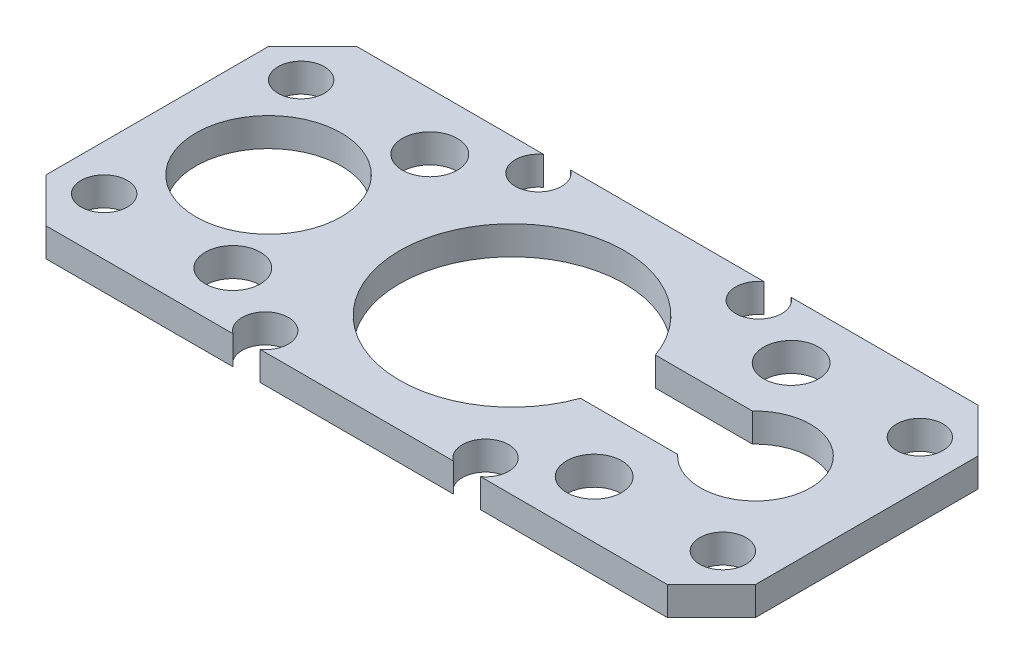
from build123d import *

# Parameters (mm, degrees)
SKETCH1_R           = 1.3335
SKETCH1_R_2         = 1.5875
BOSS_EXTRUDE1_DEPTH = 1.651
CHAMFER1_SIZE       = 2.54
SKETCH5_R           = 4.191
CUT_EXTRUDE5_DEPTH  = 23.382376376


with BuildPart() as part:
    # Sketch1 → Boss-Extrude1 (new body)
    with BuildSketch(Plane(origin=(0, 0, 0), x_dir=(1, 0, 0), z_dir=(0, 1, 0))):
        with BuildLine():
            Line((-5.567119422, 8.9535), (5.567119422, 8.9535))
            ThreePointArc((5.567119422, 8.9535), (6.35, 6.5405), (7.132880578, 8.9535))
            Line((7.132880578, 8.9535), (20.447, 8.9535))
            Line((20.447, 8.9535), (20.447, -8.9535))
            Line((20.447, -8.9535), (7.132880578, -8.9535))
            ThreePointArc((7.132880578, -8.9535), (6.35, -6.5405), (5.567119422, -8.9535))
            Line((5.567119422, -8.9535), (-5.567119422, -8.9535))
            ThreePointArc((-5.567119422, -8.9535), (-6.35, -6.5405), (-7.132880578, -8.9535))
            Line((-7.132880578, -8.9535), (-20.447, -8.9535))
            Line((-20.447, -8.9535), (-20.447, 8.9535))
            Line((-20.447, 8.9535), (-7.132880578, 8.9535))
            ThreePointArc((-7.132880578, 8.9535), (-6.35, 6.5405), (-5.567119422, 8.9535))
        make_face()
        with Locations(Location((-17.8308, 5.6769, 0), (0, 0, 90))):
            Circle(SKETCH1_R, mode=Mode.SUBTRACT)
        with Locations(Location((17.8308, 5.6769, 0), (0, 0, 90))):
            Circle(SKETCH1_R, mode=Mode.SUBTRACT)
        with Locations(Location((17.8308, -5.6769, 0), (0, 0, 90))):
            Circle(SKETCH1_R, mode=Mode.SUBTRACT)
        with Locations(Location((-17.8308, -5.6769, 0), (0, 0, 90))):
            Circle(SKETCH1_R, mode=Mode.SUBTRACT)
        with Locations(Location((-10.414, 5.6769, 0), (0, 0, 90))):
            Circle(SKETCH1_R_2, mode=Mode.SUBTRACT)
        with Locations(Location((10.414, 5.6769, 0), (0, 0, 90))):
            Circle(SKETCH1_R_2, mode=Mode.SUBTRACT)
        with Locations(Location((10.414, -5.6769, 0), (0, 0, 90))):
            Circle(SKETCH1_R_2, mode=Mode.SUBTRACT)
        with Locations(Location((-10.414, -5.6769, 0), (0, 0, 90))):
            Circle(SKETCH1_R_2, mode=Mode.SUBTRACT)
    extrude(amount=BOSS_EXTRUDE1_DEPTH)

    # Chamfer1
    chamfer1_edges = [part.edges().sort_by_distance(p)[0] for p in [
        (20.447, 0.8255, -8.9535),
        (20.447, 0.8255, 8.9535),
        (-20.447, 0.8255, 8.9535),
        (-20.447, 0.8255, -8.9535),
    ]]
    chamfer(chamfer1_edges, length=CHAMFER1_SIZE)

    # Sketch5 → Cut-Extrude5 (cut, through all)
    with BuildSketch(Plane(origin=(0, 1.651, 0), x_dir=(1, 0, 0), z_dir=(0, 1, 0))):
        with Locations(Location((-14.0335, 0, 0), (0, 0, 270))):
            Circle(SKETCH5_R)
        with BuildLine():
            Line((6.106574162, -2.159), (11.705551547, -2.159))
            ThreePointArc((11.705551547, -2.159), (17.2085, 0), (11.705551547, 2.159))
            Line((11.705551547, 2.159), (6.106574162, 2.159))
            ThreePointArc((6.106574162, 2.159), (-6.477, 0), (6.106574162, -2.159))
        make_face()
    extrude(amount=-CUT_EXTRUDE5_DEPTH, mode=Mode.SUBTRACT)


solid = part.part
